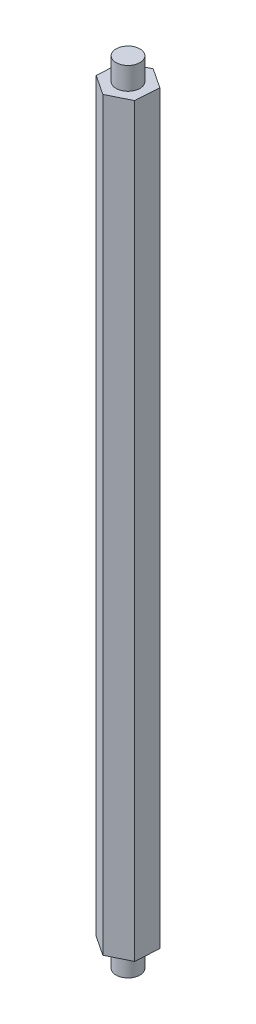
from build123d import *

# Parameters (mm, degrees)
SKETCH_1_R      = 1.6
EXTRUDE_1_DEPTH = 3
EXTRUDE_2_DEPTH = 100
SKETCH_3_R      = 1.6
EXTRUDE_3_DEPTH = 3


with BuildPart() as part:
    # 草图1 → 凸台-拉伸1 (new body)
    with BuildSketch(Plane(origin=(0, 0, 0), x_dir=(1, 0, 0), z_dir=(0, 1, 0))):
        with Locations(Location((0, 0, 0), (0, 0, 270))):
            Circle(SKETCH_1_R)
    extrude(amount=EXTRUDE_1_DEPTH)

    # 草图2 → 凸台-拉伸2 (add)
    with BuildSketch(Plane(origin=(0, 3, 0), x_dir=(1, 0, 0), z_dir=(0, 1, 0))):
        Polygon((2.652565483, -1.761424217), (2.85172086, 1.416476985), (0.199155377, 3.177901202), (-2.652565483, 1.761424217), (-2.85172086, -1.416476985), (-0.199155377, -3.177901202), align=None)
    extrude(amount=EXTRUDE_2_DEPTH)

    # 草图3 → 凸台-拉伸3 (add)
    with BuildSketch(Plane(origin=(0, 103, 0), x_dir=(1, 0, 0), z_dir=(0, 1, 0))):
        with Locations(Location((0, 0, 0), (0, 0, 270))):
            Circle(SKETCH_3_R)
    extrude(amount=EXTRUDE_3_DEPTH)


solid = part.part
